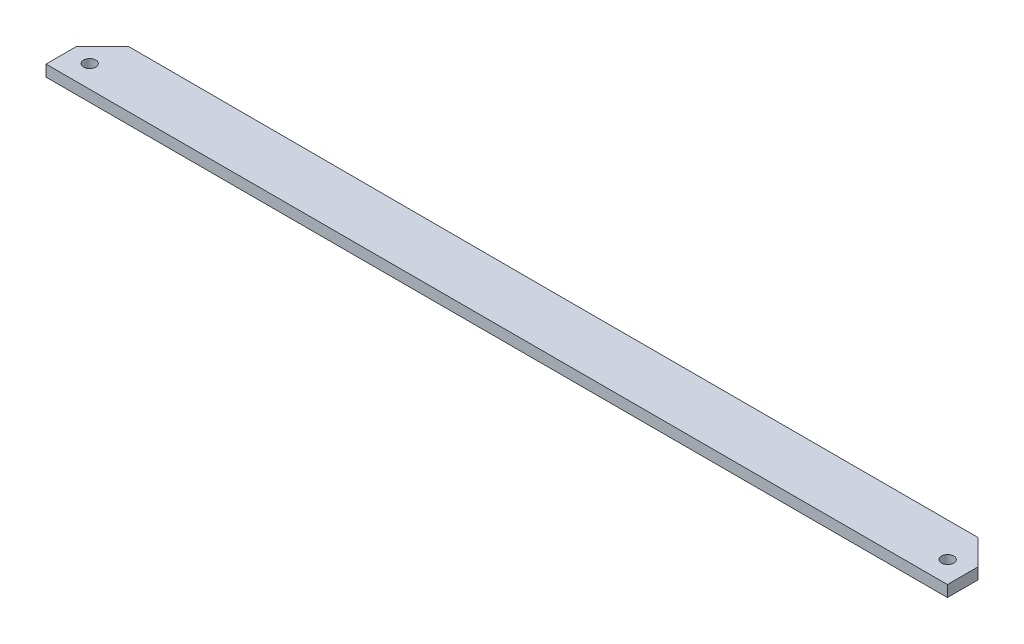
from build123d import *

# Parameters (mm, degrees)
BOSS_EXTRUDE1_DEPTH = 5.8674
SKETCH2_R           = 3.175
CUT_EXTRUDE2_DEPTH  = 10.16
SKETCH4_R           = 3.175
CUT_EXTRUDE3_DEPTH  = 10.16


with BuildPart() as part:
    # Sketch1 → Boss-Extrude1 (new body)
    with BuildSketch(Plane(origin=(0, 0, 0), x_dir=(1, 0, 0), z_dir=(0, 1, 0))):
        Polygon((0, 0), (233.866472168, 0), (233.866472168, 15.870150114), (220.6625, 29.074122282), (0, 29.074122282), (-220.662333268, 29.345384182), (-234.132717449, 15.875), (-234.132717449, 0), align=None)
    extrude(amount=BOSS_EXTRUDE1_DEPTH)

    # Sketch2 → Cut-Extrude2 (cut)
    with BuildSketch(Plane.XZ):
        with Locations(Location((-223.020217449, -11.568269312, 0), (0, 0, 270))):
            Circle(SKETCH2_R)
    extrude(amount=-CUT_EXTRUDE2_DEPTH, mode=Mode.SUBTRACT)

    # Sketch4 → Cut-Extrude3 (cut)
    with BuildSketch(Plane.XZ):
        with Locations(Location((222.690472168, -11.294122282, 0), (0, 0, 270))):
            Circle(SKETCH4_R)
    extrude(amount=-CUT_EXTRUDE3_DEPTH, mode=Mode.SUBTRACT)


solid = part.part
